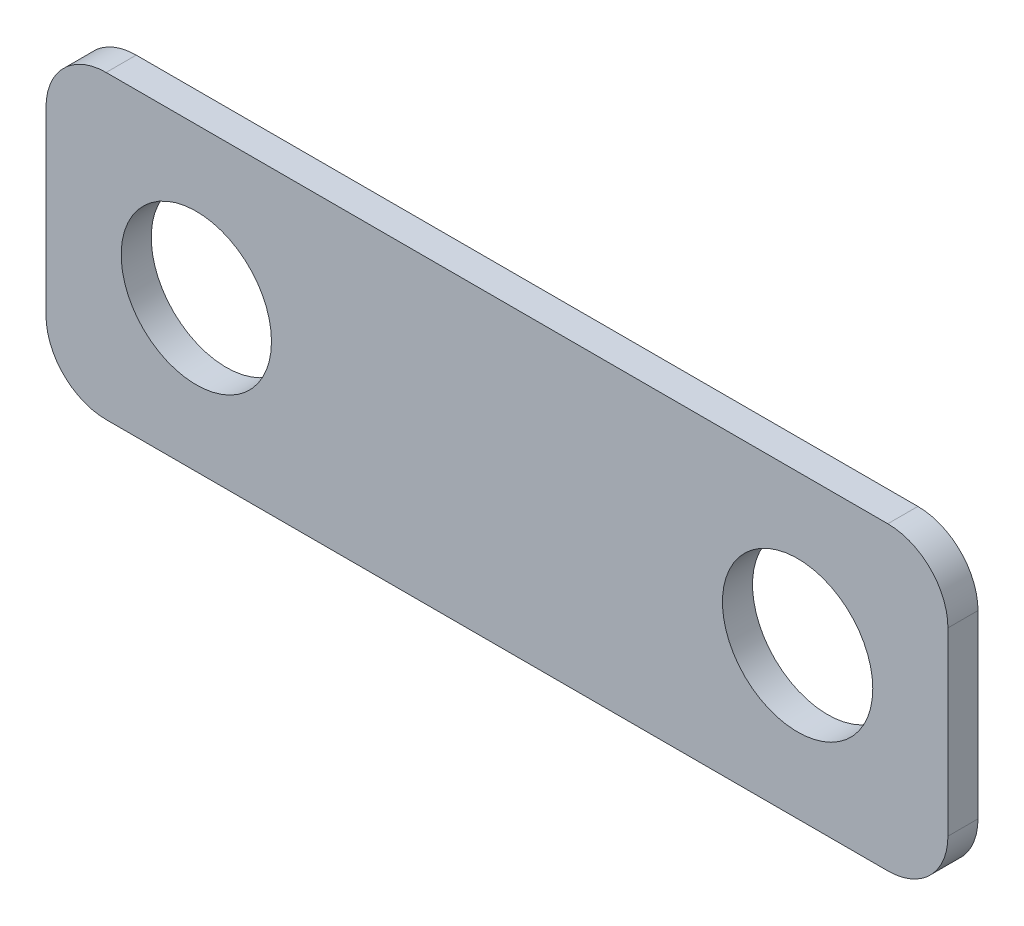
from build123d import *

# Parameters (mm, degrees)
SKETCH1_R           = 2.5
BOSS_EXTRUDE1_DEPTH = 1


with BuildPart() as part:
    # Sketch1 → Boss-Extrude1 (new body)
    with BuildSketch(Plane.XY):
        with BuildLine():
            Line((-13, -5), (13, -5))
            ThreePointArc((13, -5), (14.414213562, -4.414213562), (15, -3))
            Line((15, -3), (15, 3))
            ThreePointArc((15, 3), (14.414213562, 4.414213562), (13, 5))
            Line((13, 5), (-13, 5))
            ThreePointArc((-13, 5), (-14.414213562, 4.414213562), (-15, 3))
            Line((-15, 3), (-15, -3))
            ThreePointArc((-15, -3), (-14.414213562, -4.414213562), (-13, -5))
        make_face()
        with Locations((-10, 0)):
            Circle(SKETCH1_R, mode=Mode.SUBTRACT)
        with Locations((10, 0)):
            Circle(SKETCH1_R, mode=Mode.SUBTRACT)
    extrude(amount=BOSS_EXTRUDE1_DEPTH)


solid = part.part
